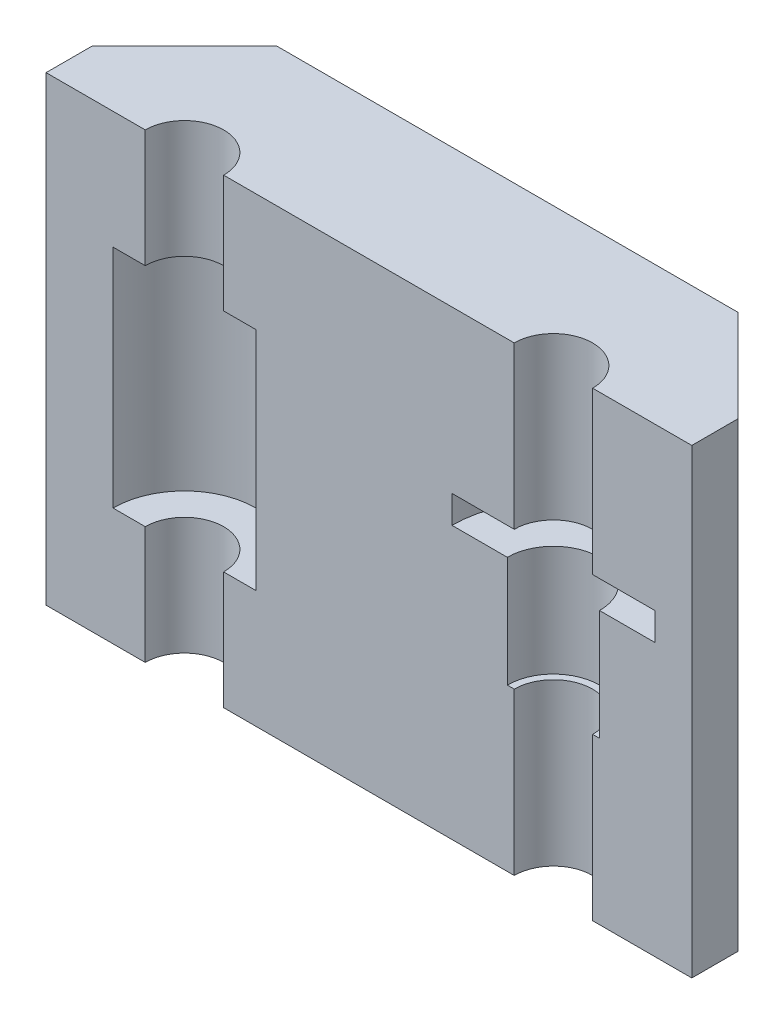
from build123d import *

# Parameters (mm, degrees)
ESQUISSE1_W                  = 70
ESQUISSE1_H                  = 50
BOSS_EXTRU_1_DEPTH           = 15
ESQUISSE2_R                  = 4.25
ENL_V_MAT_EXTRU_1_DEPTH      = 63.84902545
ENL_V_MAT_EXTRU_2_DEPTH      = 12.25
ENL_V_MAT_EXTRU_2_DEPTH_BACK = 12.25
ESQUISSE3_R                  = 7.75
ESQUISSE4_R                  = 11
ENL_V_MAT_EXTRU_3_DEPTH      = 3
ESQUISSE5_R                  = 5
ENL_V_MAT_EXTRU_4_DEPTH      = 15
CHANFREIN1_SIZE              = 10


with BuildPart() as part:
    # Esquisse1 → Boss.-Extru.1 (new body)
    with BuildSketch(Plane.XY):
        Rectangle(ESQUISSE1_W, ESQUISSE1_H)
    extrude(amount=BOSS_EXTRU_1_DEPTH)

    # Esquisse2 → Enlèv. mat.-Extru.1 (cut, through all)
    with BuildSketch(Plane(origin=(0, 25, 0), x_dir=(1, 0, 0), z_dir=(0, 1, 0))):
        with Locations((-20, -15)):
            Circle(ESQUISSE2_R)
        with Locations((20, -15)):
            Circle(ESQUISSE2_R)
    extrude(amount=-ENL_V_MAT_EXTRU_1_DEPTH, mode=Mode.SUBTRACT)

    # Esquisse3 → Enlèv. mat.-Extru.2 (cut, two sides: drawn at the far end of the back side and taken through both)
    with BuildSketch(Plane(origin=(0, 0, 0), x_dir=(1, 0, 0), z_dir=(0, 1, 0)).offset(-ENL_V_MAT_EXTRU_2_DEPTH_BACK)):
        with Locations((-20, -15)):
            Circle(ESQUISSE3_R)
    extrude(amount=ENL_V_MAT_EXTRU_2_DEPTH + ENL_V_MAT_EXTRU_2_DEPTH_BACK, mode=Mode.SUBTRACT)

    # Esquisse4 → Enlèv. mat.-Extru.3 (cut)
    with BuildSketch(Plane(origin=(0, 7.5, 0), x_dir=(1, 0, 0), z_dir=(0, 1, 0))):
        with Locations((20, -15)):
            Circle(ESQUISSE4_R)
    extrude(amount=-ENL_V_MAT_EXTRU_3_DEPTH, mode=Mode.SUBTRACT)

    # Esquisse5 → Enlèv. mat.-Extru.4 (cut)
    with BuildSketch(Plane(origin=(0, 7.5, 0), x_dir=(1, 0, 0), z_dir=(0, 1, 0))):
        with Locations((20, -15)):
            Circle(ESQUISSE5_R)
    extrude(amount=-ENL_V_MAT_EXTRU_4_DEPTH, mode=Mode.SUBTRACT)

    # Chanfrein1
    chanfrein1_edges = [part.edges().sort_by_distance(p)[0] for p in [
        (-35, 0, 0),
        (35, 0, 0),
    ]]
    chamfer(chanfrein1_edges, length=CHANFREIN1_SIZE)


solid = part.part
